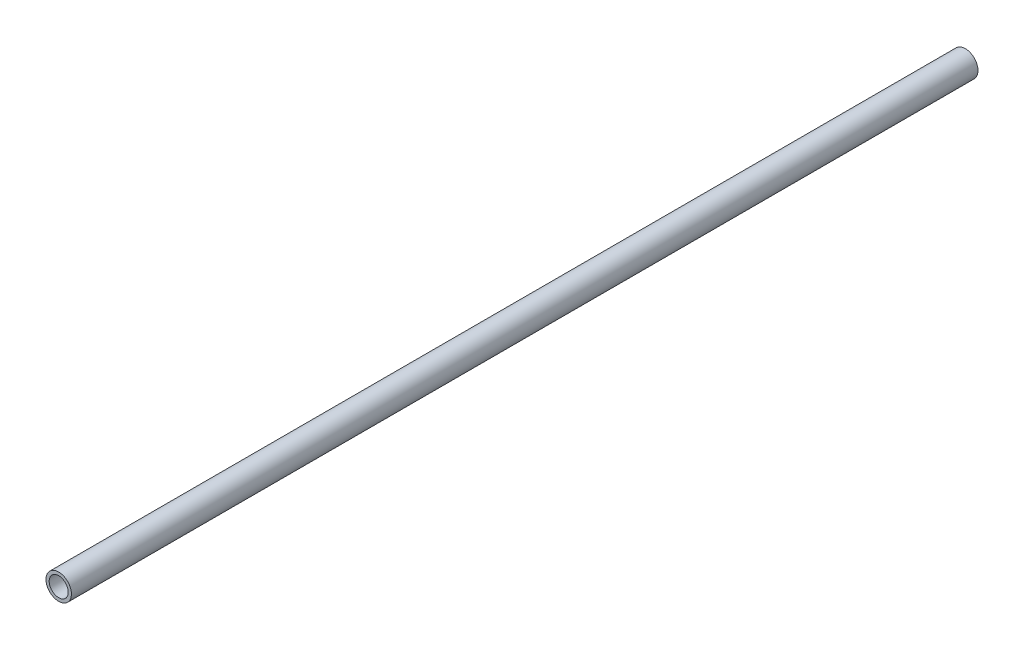
from build123d import *

# Parameters (mm, degrees)
ESQUISSE1_R        = 4
ESQUISSE1_R_2      = 3
BOSS_EXTRU_1_DEPTH = 285


with BuildPart() as part:
    # Esquisse1 → Boss.-Extru.1 (new body)
    with BuildSketch(Plane.XY):
        Circle(ESQUISSE1_R)
        Circle(ESQUISSE1_R_2, mode=Mode.SUBTRACT)
    extrude(amount=BOSS_EXTRU_1_DEPTH)


solid = part.part
